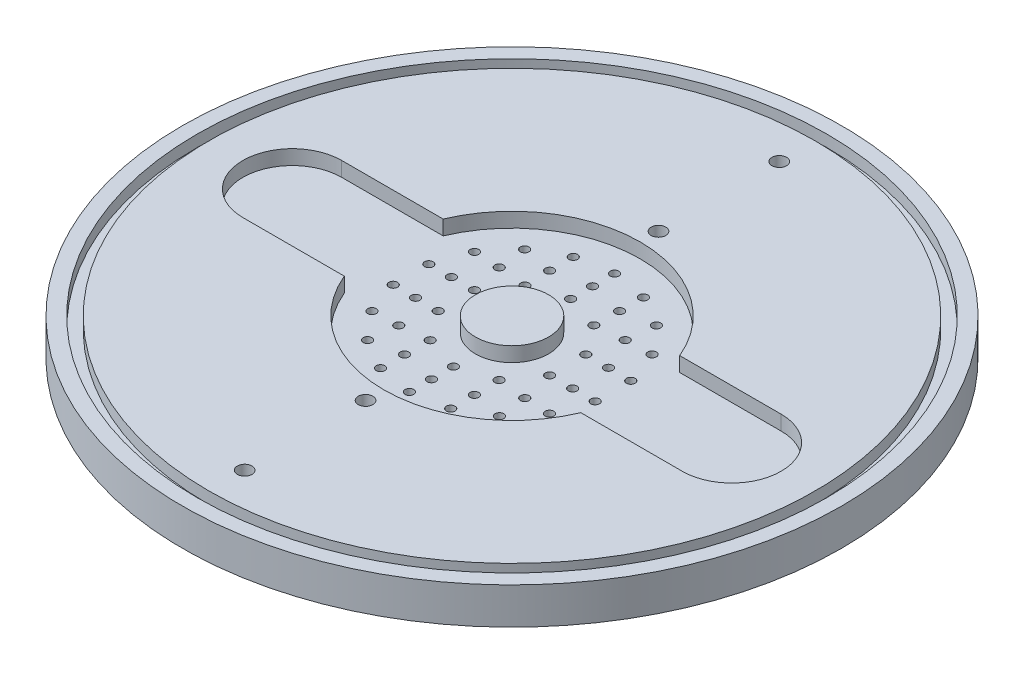
from build123d import *

# Parameters (mm, degrees)
MAIN_SHAPE_PROFILE_W          = 57.15
MAIN_SHAPE_PROFILE_H          = 6.35
O_RINGS_PROFILE_W             = 2.032
O_RINGS_PROFILE_H             = 2.032
INJECTOR_WELL_PROFILE_R       = 6.35
INJECTOR_WELL_DEPTH           = 2.54
DOWEL_HOLES_PROFILE_R         = 1.27
DOWEL_HOLES_DEPTH             = 2.54
INJECTOR_HOLES_R              = 0.7493
CIRCULAR_INJECTOR_HOLES_DEPTH = 81.912057816


with BuildPart() as part:
    # Main Shape Profile → Main Shape (revolve)
    with BuildSketch(Plane.XY, mode=Mode.PRIVATE) as main_shape_sk:
        with Locations((28.575, 3.175)):
            Rectangle(MAIN_SHAPE_PROFILE_W, MAIN_SHAPE_PROFILE_H)
    revolve(main_shape_sk.sketch.rotate(Axis((0, 0, 0), (0, -1, 0)), 180), axis=Axis((0, 0, 0), (0, -1, 0)))

    # O Rings Profile → O-Rings Cutout (revolve, cut)
    with BuildSketch(Plane.XY, mode=Mode.PRIVATE) as o_rings_cutout_sk:
        with Locations((53.594, 5.334)):
            Rectangle(O_RINGS_PROFILE_W, O_RINGS_PROFILE_H)
        with Locations((53.594, 1.016)):
            Rectangle(O_RINGS_PROFILE_W, O_RINGS_PROFILE_H)
    revolve(o_rings_cutout_sk.sketch.rotate(Axis((0, 0, 0), (0, -1, 0)), 90), axis=Axis((0, 0, 0), (0, -1, 0)), mode=Mode.SUBTRACT)

    # Injector Well Profile → Injector Well (cut)
    with BuildSketch(Plane(origin=(0, 6.35, 0), x_dir=(1, 0, 0), z_dir=(0, 1, 0))):
        with BuildLine():
            Line((-38.1, 8.57504), (-20.504129194, 8.57504))
            ThreePointArc((-20.504129194, 8.57504), (0, 22.225), (20.504129194, 8.57504))
            Line((20.504129194, 8.57504), (38.1, 8.57504))
            ThreePointArc((38.1, 8.57504), (46.67504, 0), (38.1, -8.57504))
            Line((38.1, -8.57504), (20.504129194, -8.57504))
            ThreePointArc((20.504129194, -8.57504), (0, -22.225), (-20.504129194, -8.57504))
            Line((-20.504129194, -8.57504), (-38.1, -8.57504))
            ThreePointArc((-38.1, -8.57504), (-46.67504, 0), (-38.1, 8.57504))
        make_face()
        with Locations(Location((0, 0, 0), (0, 0, 180))):
            Circle(INJECTOR_WELL_PROFILE_R, mode=Mode.SUBTRACT)
    extrude(amount=-INJECTOR_WELL_DEPTH, mode=Mode.SUBTRACT)

    # Dowel Holes Profile → Dowel Holes (cut)
    with BuildSketch(Plane(origin=(0, 6.35, 0), x_dir=(1, 0, 0), z_dir=(0, 1, 0))):
        with Locations(Location((0, 25.4, 0), (0, 0, 180))):
            Circle(DOWEL_HOLES_PROFILE_R)
        with Locations(Location((0, 46.355, 0), (0, 0, 180))):
            Circle(DOWEL_HOLES_PROFILE_R)
        with Locations(Location((0, -46.355, 0), (0, 0, 180))):
            Circle(DOWEL_HOLES_PROFILE_R)
        with Locations(Location((0, -25.4, 0), (0, 0, 180))):
            Circle(DOWEL_HOLES_PROFILE_R)
    extrude(amount=-DOWEL_HOLES_DEPTH, mode=Mode.SUBTRACT)

    # Injector Holes → Circular Injector Holes (cut, through all)
    with BuildSketch(Plane(origin=(0, 3.81, 0), x_dir=(1, 0, 0), z_dir=(0, 1, 0))):
        with Locations(Location((0, -17.78, 0), (0, 0, 180))):
            Circle(INJECTOR_HOLES_R)
        with Locations(Location((0, -13.97, 0), (0, 0, 180))):
            Circle(INJECTOR_HOLES_R)
        with Locations(Location((0, -10.16, 0), (0, 0, 180))):
            Circle(INJECTOR_HOLES_R)
        with Locations(Location((-6.081118148, -16.707734798, 0), (0, 0, 180))):
            Circle(INJECTOR_HOLES_R)
        with Locations(Location((-11.4287637, -13.620270199, 0), (0, 0, 180))):
            Circle(INJECTOR_HOLES_R)
        with Locations(Location((-15.397931679, -8.89, 0), (0, 0, 180))):
            Circle(INJECTOR_HOLES_R)
        with Locations(Location((-17.509881849, -3.087464599, 0), (0, 0, 180))):
            Circle(INJECTOR_HOLES_R)
        with Locations(Location((-17.509881849, 3.087464599, 0), (0, 0, 180))):
            Circle(INJECTOR_HOLES_R)
        with Locations(Location((-15.397931679, 8.89, 0), (0, 0, 180))):
            Circle(INJECTOR_HOLES_R)
        with Locations(Location((-11.4287637, 13.620270199, 0), (0, 0, 180))):
            Circle(INJECTOR_HOLES_R)
        with Locations(Location((-6.081118148, 16.707734798, 0), (0, 0, 180))):
            Circle(INJECTOR_HOLES_R)
        with Locations(Location((0, 17.78, 0), (0, 0, 180))):
            Circle(INJECTOR_HOLES_R)
        with Locations(Location((6.081118148, 16.707734798, 0), (0, 0, 180))):
            Circle(INJECTOR_HOLES_R)
        with Locations(Location((11.4287637, 13.620270199, 0), (0, 0, 180))):
            Circle(INJECTOR_HOLES_R)
        with Locations(Location((15.397931679, 8.89, 0), (0, 0, 180))):
            Circle(INJECTOR_HOLES_R)
        with Locations(Location((17.509881849, 3.087464599, 0), (0, 0, 180))):
            Circle(INJECTOR_HOLES_R)
        with Locations(Location((17.509881849, -3.087464599, 0), (0, 0, 180))):
            Circle(INJECTOR_HOLES_R)
        with Locations(Location((15.397931679, -8.89, 0), (0, 0, 180))):
            Circle(INJECTOR_HOLES_R)
        with Locations(Location((11.4287637, -13.620270199, 0), (0, 0, 180))):
            Circle(INJECTOR_HOLES_R)
        with Locations(Location((-6.061355835, -12.586535085, 0), (0, 0, 180))):
            Circle(INJECTOR_HOLES_R)
        with Locations(Location((-10.92218581, -8.710152532, 0), (0, 0, 180))):
            Circle(INJECTOR_HOLES_R)
        with Locations(Location((-13.619742933, -3.108617447, 0), (0, 0, 180))):
            Circle(INJECTOR_HOLES_R)
        with Locations(Location((-13.619742933, 3.108617447, 0), (0, 0, 180))):
            Circle(INJECTOR_HOLES_R)
        with Locations(Location((-10.92218581, 8.710152532, 0), (0, 0, 180))):
            Circle(INJECTOR_HOLES_R)
        with Locations(Location((-6.061355835, 12.586535085, 0), (0, 0, 180))):
            Circle(INJECTOR_HOLES_R)
        with Locations(Location((0, 13.97, 0), (0, 0, 180))):
            Circle(INJECTOR_HOLES_R)
        with Locations(Location((6.061355835, 12.586535085, 0), (0, 0, 180))):
            Circle(INJECTOR_HOLES_R)
        with Locations(Location((10.92218581, 8.710152532, 0), (0, 0, 180))):
            Circle(INJECTOR_HOLES_R)
        with Locations(Location((13.619742933, 3.108617447, 0), (0, 0, 180))):
            Circle(INJECTOR_HOLES_R)
        with Locations(Location((13.619742933, -3.108617447, 0), (0, 0, 180))):
            Circle(INJECTOR_HOLES_R)
        with Locations(Location((10.92218581, -8.710152532, 0), (0, 0, 180))):
            Circle(INJECTOR_HOLES_R)
        with Locations(Location((-5.971898163, -8.219612663, 0), (0, 0, 180))):
            Circle(INJECTOR_HOLES_R)
        with Locations(Location((-9.662734206, -3.139612663, 0), (0, 0, 180))):
            Circle(INJECTOR_HOLES_R)
        with Locations(Location((-9.662734206, 3.139612663, 0), (0, 0, 180))):
            Circle(INJECTOR_HOLES_R)
        with Locations(Location((-5.971898163, 8.219612663, 0), (0, 0, 180))):
            Circle(INJECTOR_HOLES_R)
        with Locations(Location((0, 10.16, 0), (0, 0, 180))):
            Circle(INJECTOR_HOLES_R)
        with Locations(Location((5.971898163, 8.219612663, 0), (0, 0, 180))):
            Circle(INJECTOR_HOLES_R)
        with Locations(Location((9.662734206, 3.139612663, 0), (0, 0, 180))):
            Circle(INJECTOR_HOLES_R)
        with Locations(Location((9.662734206, -3.139612663, 0), (0, 0, 180))):
            Circle(INJECTOR_HOLES_R)
        with Locations(Location((5.971898163, -8.219612663, 0), (0, 0, 180))):
            Circle(INJECTOR_HOLES_R)
        with Locations(Location((6.061355835, -12.586535085, 0), (0, 0, 180))):
            Circle(INJECTOR_HOLES_R)
        with Locations(Location((6.081118148, -16.707734798, 0), (0, 0, 180))):
            Circle(INJECTOR_HOLES_R)
    extrude(amount=-CIRCULAR_INJECTOR_HOLES_DEPTH, mode=Mode.SUBTRACT)


solid = part.part
